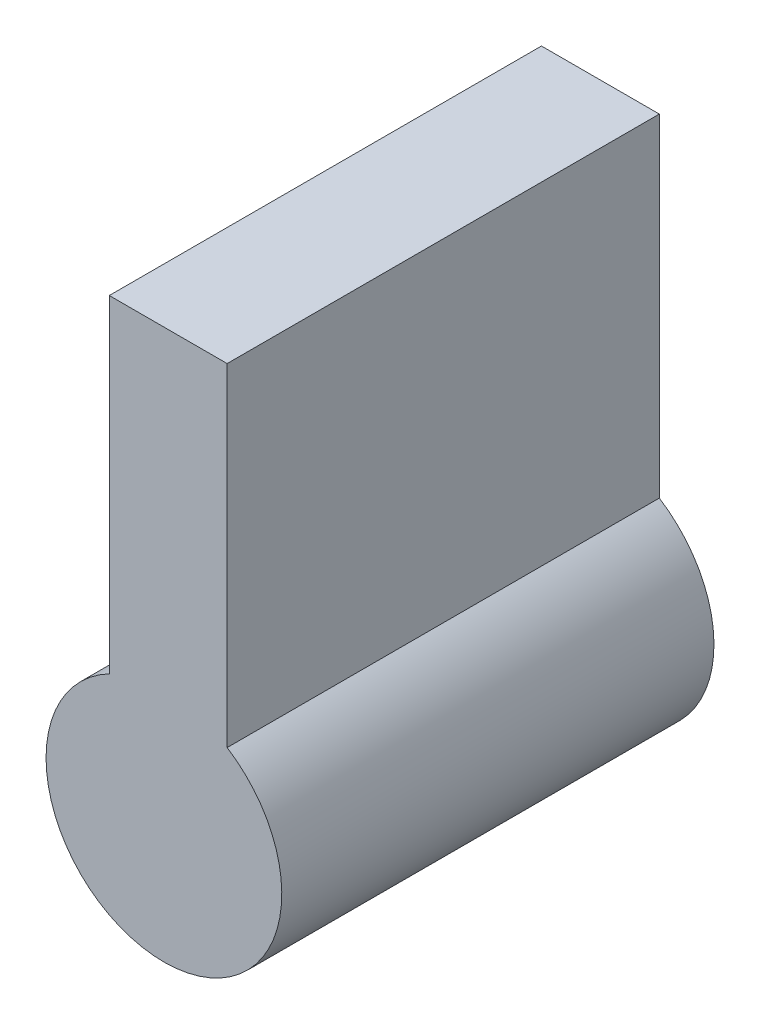
from build123d import *

# Parameters (mm, degrees)
CROQUIS1_R              = 6
CROQUIS1_R_2            = 4
SALIENTE_EXTRUIR1_DEPTH = 20
CROQUIS2_R              = 6
SALIENTE_EXTRUIR2_DEPTH = 2
SALIENTE_EXTRUIR3_REACH = 25.58


with BuildPart() as part:
    # Croquis1 → Saliente-Extruir1 (new body)
    with BuildSketch(Plane.XY):
        Circle(CROQUIS1_R)
        Circle(CROQUIS1_R_2, mode=Mode.SUBTRACT)
    extrude(amount=SALIENTE_EXTRUIR1_DEPTH)

    # Croquis2 → Saliente-Extruir2 (add)
    with BuildSketch(Plane.XY.offset(20)):
        Circle(CROQUIS2_R)
    extrude(amount=SALIENTE_EXTRUIR2_DEPTH)

    # Saliente-Extruir3: up to this face of the body (flat: up to its plane)
    saliente_extruir3_end = Plane(part.part.faces().sort_by_distance((0, 0, 22))[0])
    # Croquis3 → Saliente-Extruir3 (add, up to the picked face)
    with BuildSketch(Plane(origin=(0, 0, 0), x_dir=(-1, 0, 0), z_dir=(0, 0, -1)), mode=Mode.PRIVATE) as saliente_extruir3_sk1:
        Polygon((-0.21844428, 21.994030808), (-3.21844428, 21.994030808), (-3.21844428, 3.994030808), (2.78155572, 3.994030808), (2.78155572, 21.994030808), align=None)
    saliente_extruir3_tool1 = split(extrude(saliente_extruir3_sk1.sketch, amount=-SALIENTE_EXTRUIR3_REACH, mode=Mode.PRIVATE), bisect_by=saliente_extruir3_end, keep=Keep.BOTH, mode=Mode.PRIVATE)
    add(saliente_extruir3_tool1.solids().sort_by(Axis((0.218444, 12.994031, 0), (0, 0, 1)))[0])


solid = part.part
